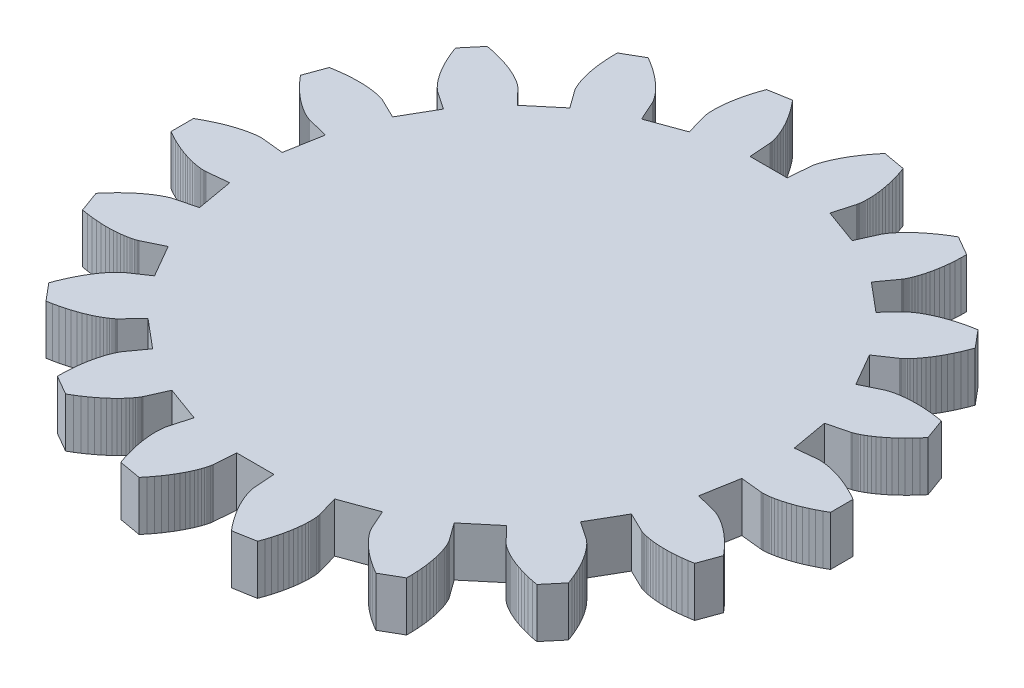
from build123d import *

# Parameters (mm, degrees)
BOSS_EXTRUDE2_DEPTH = 3


with BuildPart() as part:
    # Sketch2 → Boss-Extrude2 (new body)
    with BuildSketch(Plane(origin=(0, 0, 0), x_dir=(1, 0, 0), z_dir=(0, 1, 0))):
        Polygon((15.51864759, 1.591093014), (16.826259952, 1.725159651), (16.835556635, 1.725905272), (16.863500173, 1.727317977), (16.910124575, 1.728159263), (16.975402145, 1.727189783), (17.059243486, 1.723172087), (17.161497616, 1.714873343), (17.281952202, 1.701068068), (17.420333904, 1.680540836), (17.576308828, 1.65208898), (17.749483097, 1.614525265), (17.93940353, 1.566680542), (18.145558428, 1.507406375), (18.367378477, 1.435577629), (18.604237745, 1.350095023), (18.855454802, 1.249887645), (19.120293927, 1.133915415), (19.397966429, 1.001171503), (19.687632065, 0.850684686), (19.988400552, 0.681521658), (19.988400552, -0.681521658), (19.687632065, -0.850684686), (19.397966429, -1.001171503), (19.120293927, -1.133915415), (18.855454802, -1.249887645), (18.604237745, -1.350095023), (18.367378477, -1.435577629), (18.145558428, -1.507406375), (17.93940353, -1.566680542), (17.749483097, -1.614525265), (17.576308828, -1.65208898), (17.420333904, -1.680540836), (17.281952202, -1.701068068), (17.161497616, -1.714873343), (17.059243486, -1.723172087), (16.975402145, -1.727189783), (16.910124575, -1.728159263), (16.863500173, -1.727317977), (16.835556635, -1.725905272), (16.826259952, -1.725159651), (15.51864759, -1.591093014), (15.126944486, -3.812551709), (16.401551663, -4.133800047), (16.410542705, -4.136279045), (16.437284215, -4.144508789), (16.481384559, -4.159664724), (16.542393828, -4.182901981), (16.619804784, -4.215352808), (16.713053898, -4.258124048), (16.821522502, -4.312294658), (16.944538039, -4.378913276), (17.081375416, -4.458995841), (17.231258452, -4.553523275), (17.393361422, -4.663439222), (17.5668107, -4.789647847), (17.750686484, -4.933011715), (17.944024618, -5.09434973), (18.14581849, -5.274435157), (18.355021023, -5.473993721), (18.570546732, -5.693701785), (18.79127387, -5.934184618), (19.016046635, -6.196014749), (18.549858365, -7.476856495), (18.209371274, -7.532948863), (17.885705091, -7.575288731), (17.579377197, -7.605057617), (17.290844987, -7.62345555), (17.020505231, -7.63169839), (16.768693551, -7.631015123), (16.535684011, -7.622645142), (16.321688815, -7.607835511), (16.126858127, -7.587838231), (15.951279997, -7.563907488), (15.794980404, -7.537296922), (15.657923413, -7.50925688), (15.540011445, -7.4810317), (15.441085656, -7.453856997), (15.360926434, -7.428956969), (15.299254001, -7.407541738), (15.255729131, -7.390804703), (15.229953968, -7.379919941), (15.221472961, -7.376039634), (14.038572764, -6.802828437), (12.910708626, -8.756346428), (13.998574183, -9.49416245), (14.006175131, -9.499567064), (14.028489193, -9.516446629), (14.064746325, -9.545771755), (14.114128676, -9.588474033), (14.175772343, -9.645443942), (14.248769221, -9.717528836), (14.332168928, -9.805531006), (14.424980812, -9.910205821), (14.526176035, -10.032259956), (14.634689731, -10.172349706), (14.749423228, -10.331079391), (14.869246342, -10.508999851), (14.992999729, -10.706607042), (15.119497296, -10.92434072), (15.247528665, -11.162583237), (15.375861693, -11.421658427), (15.503245028, -11.701830608), (15.628410717, -12.003303679), (15.750076847, -12.326220333), (14.873929492, -13.370372091), (14.534791565, -13.306628232), (14.216163754, -13.23571434), (13.918128134, -13.158917632), (13.640704082, -13.077522206), (13.38384859, -12.9928063), (13.147456704, -12.906039572), (12.931362061, -12.818480406), (12.735337546, -12.731373238), (12.559096059, -12.645945921), (12.402291382, -12.563407122), (12.264519157, -12.484943759), (12.145317974, -12.411718488), (12.044170547, -12.344867226), (11.960505009, -12.285496745), (11.893696291, -12.234682304), (11.843067602, -12.193465355), (11.807892005, -12.162851305), (11.787394083, -12.14380735), (11.780751686, -12.137260379), (10.865238876, -11.194042352), (9.137250765, -12.643996538), (9.907162059, -13.709388743), (9.912456127, -13.717067097), (9.927651335, -13.740560558), (9.951692111, -13.780517832), (9.983491302, -13.837534606), (10.021932545, -13.912152185), (10.065872687, -14.004856231), (10.114144262, -14.1160756), (10.165558009, -14.246181285), (10.218905441, -14.39548546), (10.272961443, -14.564240634), (10.326486914, -14.752638915), (10.378231429, -14.960811377), (10.426935934, -15.188827547), (10.47133546, -15.436694994), (10.510161853, -15.704359036), (10.542146519, -15.991702561), (10.566023169, -16.298545958), (10.580530581, -16.624647165), (10.584415345, -16.96970183), (9.403985207, -17.651223488), (9.107101484, -17.475331852), (8.83194326, -17.299717461), (8.578147408, -17.125617976), (8.345292949, -16.954246681), (8.132902285, -16.786790017), (7.940442543, -16.624405176), (7.767326999, -16.468217753), (7.612916616, -16.319319457), (7.476521654, -16.178765899), (7.357403388, -16.04757444), (7.254775896, -15.926722122), (7.167807941, -15.817143668), (7.095624929, -15.719729574), (7.037310941, -15.635324272), (6.991910843, -15.564724389), (6.958432464, -15.508677095), (6.935848838, -15.467878535), (6.923100507, -15.442972368), (6.919097892, -15.434548394), (6.381396825, -14.235089552), (4.26170561, -15.00659406), (4.620799977, -16.271060425), (4.623148622, -16.280086395), (4.62939221, -16.307360094), (4.638316957, -16.353130079), (4.648697537, -16.417584285), (4.659299775, -16.500849553), (4.668883351, -16.602991275), (4.676204528, -16.724013146), (4.680018882, -16.863857035), (4.679084035, -17.022402963), (4.672162393, -17.199469196), (4.658023876, -17.39481246), (4.635448639, -17.608128253), (4.60322978, -17.839051287), (4.560176027, -18.08715603), (4.505114408, -18.351957363), (4.436892889, -18.632911353), (4.354382979, -18.929416125), (4.256482305, -19.24081285), (4.142117143, -19.56638684), (2.799781518, -19.803076828), (2.580960556, -19.536252541), (2.382460063, -19.277119339), (2.203515505, -19.026716044), (2.043316322, -18.786038787), (1.901007936, -18.556039111), (1.775693822, -18.337622165), (1.666437669, -18.131644993), (1.572265587, -17.938914902), (1.492168396, -17.760187936), (1.425103962, -17.596167444), (1.369999592, -17.447502743), (1.325754485, -17.314787886), (1.291242223, -17.198560536), (1.265313313, -17.099300938), (1.246797758, -17.017431002), (1.234507676, -16.953313493), (1.227239938, -16.907251332), (1.223778837, -16.879487005), (1.222898778, -16.870202084), (1.127864138, -15.559174865), (-1.127864138, -15.559174865), (-1.222898778, -16.870202084), (-1.223778837, -16.879487005), (-1.227239938, -16.907251332), (-1.234507676, -16.953313493), (-1.246797758, -17.017431002), (-1.265313313, -17.099300938), (-1.291242223, -17.198560536), (-1.325754485, -17.314787886), (-1.369999592, -17.447502743), (-1.425103962, -17.596167444), (-1.492168396, -17.760187936), (-1.572265587, -17.938914902), (-1.666437669, -18.131644993), (-1.775693822, -18.337622165), (-1.901007936, -18.556039111), (-2.043316322, -18.786038787), (-2.203515505, -19.026716044), (-2.382460063, -19.277119339), (-2.580960556, -19.536252541), (-2.799781518, -19.803076828), (-4.142117143, -19.56638684), (-4.256482305, -19.24081285), (-4.354382979, -18.929416125), (-4.436892889, -18.632911353), (-4.505114408, -18.351957363), (-4.560176027, -18.08715603), (-4.60322978, -17.839051287), (-4.635448639, -17.608128253), (-4.658023876, -17.39481246), (-4.672162393, -17.199469196), (-4.679084035, -17.022402963), (-4.680018882, -16.863857035), (-4.676204528, -16.724013146), (-4.668883351, -16.602991275), (-4.659299775, -16.500849553), (-4.648697537, -16.417584285), (-4.638316957, -16.353130079), (-4.62939221, -16.307360094), (-4.623148622, -16.280086395), (-4.620799977, -16.271060425), (-4.26170561, -15.00659406), (-6.381396825, -14.235089552), (-6.919097892, -15.434548394), (-6.923100507, -15.442972368), (-6.935848838, -15.467878535), (-6.958432464, -15.508677095), (-6.991910843, -15.564724389), (-7.037310941, -15.635324272), (-7.095624929, -15.719729574), (-7.167807941, -15.817143668), (-7.254775896, -15.926722122), (-7.357403388, -16.04757444), (-7.476521654, -16.178765899), (-7.612916616, -16.319319457), (-7.767326999, -16.468217753), (-7.940442543, -16.624405176), (-8.132902285, -16.786790017), (-8.345292949, -16.954246681), (-8.578147408, -17.125617976), (-8.83194326, -17.299717461), (-9.107101484, -17.475331852), (-9.403985207, -17.651223488), (-10.584415345, -16.96970183), (-10.580530581, -16.624647165), (-10.566023169, -16.298545958), (-10.542146519, -15.991702561), (-10.510161853, -15.704359036), (-10.47133546, -15.436694994), (-10.426935934, -15.188827547), (-10.378231429, -14.960811377), (-10.326486914, -14.752638915), (-10.272961443, -14.564240634), (-10.218905441, -14.39548546), (-10.165558009, -14.246181285), (-10.114144262, -14.1160756), (-10.065872687, -14.004856231), (-10.021932545, -13.912152185), (-9.983491302, -13.837534606), (-9.951692111, -13.780517832), (-9.927651335, -13.740560558), (-9.912456127, -13.717067097), (-9.907162059, -13.709388743), (-9.137250765, -12.643996538), (-10.865238876, -11.194042352), (-11.780751686, -12.137260379), (-11.787394083, -12.14380735), (-11.807892005, -12.162851305), (-11.843067602, -12.193465355), (-11.893696291, -12.234682304), (-11.960505009, -12.285496745), (-12.044170547, -12.344867226), (-12.145317974, -12.411718488), (-12.264519157, -12.484943759), (-12.402291382, -12.563407122), (-12.559096059, -12.645945921), (-12.735337546, -12.731373238), (-12.931362061, -12.818480406), (-13.147456704, -12.906039572), (-13.38384859, -12.9928063), (-13.640704082, -13.077522206), (-13.918128134, -13.158917632), (-14.216163754, -13.23571434), (-14.534791565, -13.306628232), (-14.873929492, -13.370372091), (-15.750076847, -12.326220333), (-15.628410717, -12.003303679), (-15.503245028, -11.701830608), (-15.375861693, -11.421658427), (-15.247528665, -11.162583237), (-15.119497296, -10.92434072), (-14.992999729, -10.706607042), (-14.869246342, -10.508999851), (-14.749423228, -10.331079391), (-14.634689731, -10.172349706), (-14.526176035, -10.032259956), (-14.424980812, -9.910205821), (-14.332168928, -9.805531006), (-14.248769221, -9.717528836), (-14.175772343, -9.645443942), (-14.114128676, -9.588474033), (-14.064746325, -9.545771755), (-14.028489193, -9.516446629), (-14.006175131, -9.499567064), (-13.998574183, -9.49416245), (-12.910708626, -8.756346428), (-14.038572764, -6.802828437), (-15.221472961, -7.376039634), (-15.229953968, -7.379919941), (-15.255729131, -7.390804703), (-15.299254001, -7.407541738), (-15.360926434, -7.428956969), (-15.441085656, -7.453856997), (-15.540011445, -7.4810317), (-15.657923413, -7.50925688), (-15.794980404, -7.537296922), (-15.951279997, -7.563907488), (-16.126858127, -7.587838231), (-16.321688815, -7.607835511), (-16.535684011, -7.622645142), (-16.768693551, -7.631015123), (-17.020505231, -7.63169839), (-17.290844987, -7.62345555), (-17.579377197, -7.605057617), (-17.885705091, -7.575288731), (-18.209371274, -7.532948863), (-18.549858365, -7.476856495), (-19.016046635, -6.196014749), (-18.79127387, -5.934184618), (-18.570546732, -5.693701785), (-18.355021023, -5.473993721), (-18.14581849, -5.274435157), (-17.944024618, -5.09434973), (-17.750686484, -4.933011715), (-17.5668107, -4.789647847), (-17.393361422, -4.663439222), (-17.231258452, -4.553523275), (-17.081375416, -4.458995841), (-16.944538039, -4.378913276), (-16.821522502, -4.312294658), (-16.713053898, -4.258124048), (-16.619804784, -4.215352808), (-16.542393828, -4.182901981), (-16.481384559, -4.159664724), (-16.437284215, -4.144508789), (-16.410542705, -4.136279045), (-16.401551663, -4.133800047), (-15.126944486, -3.812551709), (-15.51864759, -1.591093014), (-16.826259952, -1.725159651), (-16.835556635, -1.725905272), (-16.863500173, -1.727317977), (-16.910124575, -1.728159263), (-16.975402145, -1.727189783), (-17.059243486, -1.723172087), (-17.161497616, -1.714873343), (-17.281952202, -1.701068068), (-17.420333904, -1.680540836), (-17.576308828, -1.65208898), (-17.749483097, -1.614525265), (-17.93940353, -1.566680542), (-18.145558428, -1.507406375), (-18.367378477, -1.435577629), (-18.604237745, -1.350095023), (-18.855454802, -1.249887645), (-19.120293927, -1.133915415), (-19.397966429, -1.001171503), (-19.687632065, -0.850684686), (-19.988400552, -0.681521658), (-19.988400552, 0.681521658), (-19.687632065, 0.850684686), (-19.397966429, 1.001171503), (-19.120293927, 1.133915415), (-18.855454802, 1.249887645), (-18.604237745, 1.350095023), (-18.367378477, 1.435577629), (-18.145558428, 1.507406375), (-17.93940353, 1.566680542), (-17.749483097, 1.614525265), (-17.576308828, 1.65208898), (-17.420333904, 1.680540836), (-17.281952202, 1.701068068), (-17.161497616, 1.714873343), (-17.059243486, 1.723172087), (-16.975402145, 1.727189783), (-16.910124575, 1.728159263), (-16.863500173, 1.727317977), (-16.835556635, 1.725905272), (-16.826259952, 1.725159651), (-15.51864759, 1.591093014), (-15.126944486, 3.812551709), (-16.401551663, 4.133800047), (-16.410542705, 4.136279045), (-16.437284215, 4.144508789), (-16.481384559, 4.159664724), (-16.542393828, 4.182901981), (-16.619804784, 4.215352808), (-16.713053898, 4.258124048), (-16.821522502, 4.312294658), (-16.944538039, 4.378913276), (-17.081375416, 4.458995841), (-17.231258452, 4.553523275), (-17.393361422, 4.663439222), (-17.5668107, 4.789647847), (-17.750686484, 4.933011715), (-17.944024618, 5.09434973), (-18.14581849, 5.274435157), (-18.355021023, 5.473993721), (-18.570546732, 5.693701785), (-18.79127387, 5.934184618), (-19.016046635, 6.196014749), (-18.549858365, 7.476856495), (-18.209371274, 7.532948863), (-17.885705091, 7.575288731), (-17.579377197, 7.605057617), (-17.290844987, 7.62345555), (-17.020505231, 7.63169839), (-16.768693551, 7.631015123), (-16.535684011, 7.622645142), (-16.321688815, 7.607835511), (-16.126858127, 7.587838231), (-15.951279997, 7.563907488), (-15.794980404, 7.537296922), (-15.657923413, 7.50925688), (-15.540011445, 7.4810317), (-15.441085656, 7.453856997), (-15.360926434, 7.428956969), (-15.299254001, 7.407541738), (-15.255729131, 7.390804703), (-15.229953968, 7.379919941), (-15.221472961, 7.376039634), (-14.038572764, 6.802828437), (-12.910708626, 8.756346428), (-13.998574183, 9.49416245), (-14.006175131, 9.499567064), (-14.028489193, 9.516446629), (-14.064746325, 9.545771755), (-14.114128676, 9.588474033), (-14.175772343, 9.645443942), (-14.248769221, 9.717528836), (-14.332168928, 9.805531006), (-14.424980812, 9.910205821), (-14.526176035, 10.032259956), (-14.634689731, 10.172349706), (-14.749423228, 10.331079391), (-14.869246342, 10.508999851), (-14.992999729, 10.706607042), (-15.119497296, 10.92434072), (-15.247528665, 11.162583237), (-15.375861693, 11.421658427), (-15.503245028, 11.701830608), (-15.628410717, 12.003303679), (-15.750076847, 12.326220333), (-14.873929492, 13.370372091), (-14.534791565, 13.306628232), (-14.216163754, 13.23571434), (-13.918128134, 13.158917632), (-13.640704082, 13.077522206), (-13.38384859, 12.9928063), (-13.147456704, 12.906039572), (-12.931362061, 12.818480406), (-12.735337546, 12.731373238), (-12.559096059, 12.645945921), (-12.402291382, 12.563407122), (-12.264519157, 12.484943759), (-12.145317974, 12.411718488), (-12.044170547, 12.344867226), (-11.960505009, 12.285496745), (-11.893696291, 12.234682304), (-11.843067602, 12.193465355), (-11.807892005, 12.162851305), (-11.787394083, 12.14380735), (-11.780751686, 12.137260379), (-10.865238876, 11.194042352), (-9.137250765, 12.643996538), (-9.907162059, 13.709388743), (-9.912456127, 13.717067097), (-9.927651335, 13.740560558), (-9.951692111, 13.780517832), (-9.983491302, 13.837534606), (-10.021932545, 13.912152185), (-10.065872687, 14.004856231), (-10.114144262, 14.1160756), (-10.165558009, 14.246181285), (-10.218905441, 14.39548546), (-10.272961443, 14.564240634), (-10.326486914, 14.752638915), (-10.378231429, 14.960811377), (-10.426935934, 15.188827547), (-10.47133546, 15.436694994), (-10.510161853, 15.704359036), (-10.542146519, 15.991702561), (-10.566023169, 16.298545958), (-10.580530581, 16.624647165), (-10.584415345, 16.96970183), (-9.403985207, 17.651223488), (-9.107101484, 17.475331852), (-8.83194326, 17.299717461), (-8.578147408, 17.125617976), (-8.345292949, 16.954246681), (-8.132902285, 16.786790017), (-7.940442543, 16.624405176), (-7.767326999, 16.468217753), (-7.612916616, 16.319319457), (-7.476521654, 16.178765899), (-7.357403388, 16.04757444), (-7.254775896, 15.926722122), (-7.167807941, 15.817143668), (-7.095624929, 15.719729574), (-7.037310941, 15.635324272), (-6.991910843, 15.564724389), (-6.958432464, 15.508677095), (-6.935848838, 15.467878535), (-6.923100507, 15.442972368), (-6.919097892, 15.434548394), (-6.381396825, 14.235089552), (-4.26170561, 15.00659406), (-4.620799977, 16.271060425), (-4.623148622, 16.280086395), (-4.62939221, 16.307360094), (-4.638316957, 16.353130079), (-4.648697537, 16.417584285), (-4.659299775, 16.500849553), (-4.668883351, 16.602991275), (-4.676204528, 16.724013146), (-4.680018882, 16.863857035), (-4.679084035, 17.022402963), (-4.672162393, 17.199469196), (-4.658023876, 17.39481246), (-4.635448639, 17.608128253), (-4.60322978, 17.839051287), (-4.560176027, 18.08715603), (-4.505114408, 18.351957363), (-4.436892889, 18.632911353), (-4.354382979, 18.929416125), (-4.256482305, 19.24081285), (-4.142117143, 19.56638684), (-2.799781518, 19.803076828), (-2.580960556, 19.536252541), (-2.382460063, 19.277119339), (-2.203515505, 19.026716044), (-2.043316322, 18.786038787), (-1.901007936, 18.556039111), (-1.775693822, 18.337622165), (-1.666437669, 18.131644993), (-1.572265587, 17.938914902), (-1.492168396, 17.760187936), (-1.425103962, 17.596167444), (-1.369999592, 17.447502743), (-1.325754485, 17.314787886), (-1.291242223, 17.198560536), (-1.265313313, 17.099300938), (-1.246797758, 17.017431002), (-1.234507676, 16.953313493), (-1.227239938, 16.907251332), (-1.223778837, 16.879487005), (-1.222898778, 16.870202084), (-1.127864138, 15.559174865), (1.127864138, 15.559174865), (1.222898778, 16.870202084), (1.223778837, 16.879487005), (1.227239938, 16.907251332), (1.234507676, 16.953313493), (1.246797758, 17.017431002), (1.265313313, 17.099300938), (1.291242223, 17.198560536), (1.325754485, 17.314787886), (1.369999592, 17.447502743), (1.425103962, 17.596167444), (1.492168396, 17.760187936), (1.572265587, 17.938914902), (1.666437669, 18.131644993), (1.775693822, 18.337622165), (1.901007936, 18.556039111), (2.043316322, 18.786038787), (2.203515505, 19.026716044), (2.382460063, 19.277119339), (2.580960556, 19.536252541), (2.799781518, 19.803076828), (4.142117143, 19.56638684), (4.256482305, 19.24081285), (4.354382979, 18.929416125), (4.436892889, 18.632911353), (4.505114408, 18.351957363), (4.560176027, 18.08715603), (4.60322978, 17.839051287), (4.635448639, 17.608128253), (4.658023876, 17.39481246), (4.672162393, 17.199469196), (4.679084035, 17.022402963), (4.680018882, 16.863857035), (4.676204528, 16.724013146), (4.668883351, 16.602991275), (4.659299775, 16.500849553), (4.648697537, 16.417584285), (4.638316957, 16.353130079), (4.62939221, 16.307360094), (4.623148622, 16.280086395), (4.620799977, 16.271060425), (4.26170561, 15.00659406), (6.381396825, 14.235089552), (6.919097892, 15.434548394), (6.923100507, 15.442972368), (6.935848838, 15.467878535), (6.958432464, 15.508677095), (6.991910843, 15.564724389), (7.037310941, 15.635324272), (7.095624929, 15.719729574), (7.167807941, 15.817143668), (7.254775896, 15.926722122), (7.357403388, 16.04757444), (7.476521654, 16.178765899), (7.612916616, 16.319319457), (7.767326999, 16.468217753), (7.940442543, 16.624405176), (8.132902285, 16.786790017), (8.345292949, 16.954246681), (8.578147408, 17.125617976), (8.83194326, 17.299717461), (9.107101484, 17.475331852), (9.403985207, 17.651223488), (10.584415345, 16.96970183), (10.580530581, 16.624647165), (10.566023169, 16.298545958), (10.542146519, 15.991702561), (10.510161853, 15.704359036), (10.47133546, 15.436694994), (10.426935934, 15.188827547), (10.378231429, 14.960811377), (10.326486914, 14.752638915), (10.272961443, 14.564240634), (10.218905441, 14.39548546), (10.165558009, 14.246181285), (10.114144262, 14.1160756), (10.065872687, 14.004856231), (10.021932545, 13.912152185), (9.983491302, 13.837534606), (9.951692111, 13.780517832), (9.927651335, 13.740560558), (9.912456127, 13.717067097), (9.907162059, 13.709388743), (9.137250765, 12.643996538), (10.865238876, 11.194042352), (11.780751686, 12.137260379), (11.787394083, 12.14380735), (11.807892005, 12.162851305), (11.843067602, 12.193465355), (11.893696291, 12.234682304), (11.960505009, 12.285496745), (12.044170547, 12.344867226), (12.145317974, 12.411718488), (12.264519157, 12.484943759), (12.402291382, 12.563407122), (12.559096059, 12.645945921), (12.735337546, 12.731373238), (12.931362061, 12.818480406), (13.147456704, 12.906039572), (13.38384859, 12.9928063), (13.640704082, 13.077522206), (13.918128134, 13.158917632), (14.216163754, 13.23571434), (14.534791565, 13.306628232), (14.873929492, 13.370372091), (15.750076847, 12.326220333), (15.628410717, 12.003303679), (15.503245028, 11.701830608), (15.375861693, 11.421658427), (15.247528665, 11.162583237), (15.119497296, 10.92434072), (14.992999729, 10.706607042), (14.869246342, 10.508999851), (14.749423228, 10.331079391), (14.634689731, 10.172349706), (14.526176035, 10.032259956), (14.424980812, 9.910205821), (14.332168928, 9.805531006), (14.248769221, 9.717528836), (14.175772343, 9.645443942), (14.114128676, 9.588474033), (14.064746325, 9.545771755), (14.028489193, 9.516446629), (14.006175131, 9.499567064), (13.998574183, 9.49416245), (12.910708626, 8.756346428), (14.038572764, 6.802828437), (15.221472961, 7.376039634), (15.229953968, 7.379919941), (15.255729131, 7.390804703), (15.299254001, 7.407541738), (15.360926434, 7.428956969), (15.441085656, 7.453856997), (15.540011445, 7.4810317), (15.657923413, 7.50925688), (15.794980404, 7.537296922), (15.951279997, 7.563907488), (16.126858127, 7.587838231), (16.321688815, 7.607835511), (16.535684011, 7.622645142), (16.768693551, 7.631015123), (17.020505231, 7.63169839), (17.290844987, 7.62345555), (17.579377197, 7.605057617), (17.885705091, 7.575288731), (18.209371274, 7.532948863), (18.549858365, 7.476856495), (19.016046635, 6.196014749), (18.79127387, 5.934184618), (18.570546732, 5.693701785), (18.355021023, 5.473993721), (18.14581849, 5.274435157), (17.944024618, 5.09434973), (17.750686484, 4.933011715), (17.5668107, 4.789647847), (17.393361422, 4.663439222), (17.231258452, 4.553523275), (17.081375416, 4.458995841), (16.944538039, 4.378913276), (16.821522502, 4.312294658), (16.713053898, 4.258124048), (16.619804784, 4.215352808), (16.542393828, 4.182901981), (16.481384559, 4.159664724), (16.437284215, 4.144508789), (16.410542705, 4.136279045), (16.401551663, 4.133800047), (15.126944486, 3.812551709), align=None)
    extrude(amount=BOSS_EXTRUDE2_DEPTH)


solid = part.part
